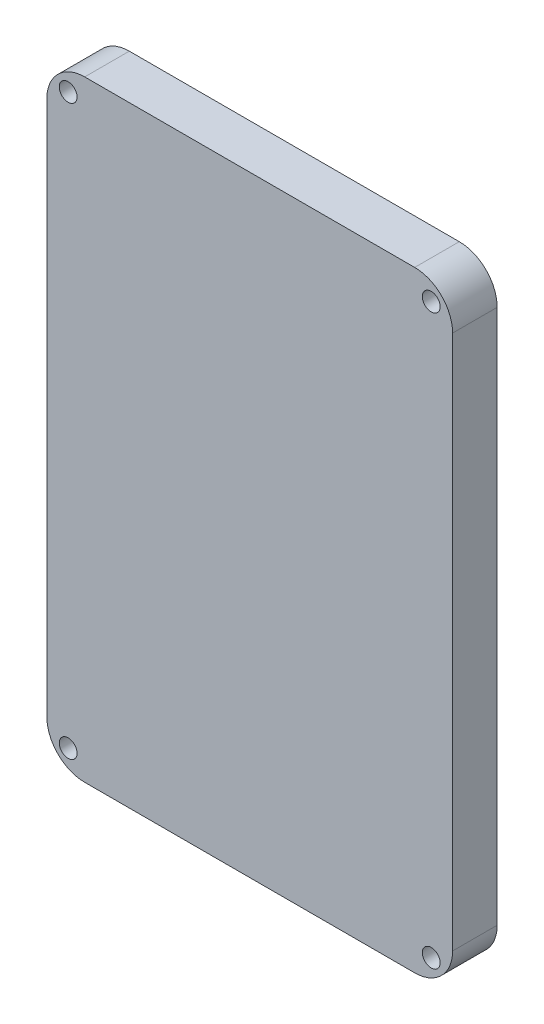
from build123d import *

# Parameters (mm, degrees)
CASE_2_DEPTH            = 10
INTERNAL_START          = -2
INTERNAL_SLOT_DEPTH     = 3
CUT_EXTRUDE1_DEPTH      = 83.840207629
CUT_EXTRUDE1_DEPTH_BACK = 83.840207629
SKETCH3_R               = 2


with BuildPart() as part:
    # Sketch1 → Case 2 (new body)
    with BuildSketch(Plane(origin=(0, 0, 0), x_dir=(0, 1, 0), z_dir=(0, 0, 1))):
        with BuildLine():
            Line((-60, -45.5), (60, -45.5))
            ThreePointArc((60, -45.5), (66.01040764, -43.01040764), (68.5, -37))
            Line((68.5, -37), (68.5, 37))
            ThreePointArc((68.5, 37), (66.01040764, 43.01040764), (60, 45.5))
            Line((60, 45.5), (-60, 45.5))
            ThreePointArc((-60, 45.5), (-66.01040764, 43.01040764), (-68.5, 37))
            Line((-68.5, 37), (-68.5, -37))
            ThreePointArc((-68.5, -37), (-66.01040764, -43.01040764), (-60, -45.5))
        make_face()
    extrude(amount=CASE_2_DEPTH)

    # Sketch2 → internal slot (cut)
    with BuildSketch(Plane.XY.offset(10).offset(INTERNAL_START)):
        with BuildLine():
            Line((-37, -62), (37, -62))
            ThreePointArc((37, -62), (38.414213562, -61.414213562), (39, -60))
            Line((39, -60), (39, 60))
            ThreePointArc((39, 60), (38.414213562, 61.414213562), (37, 62))
            Line((37, 62), (-37, 62))
            ThreePointArc((-37, 62), (-38.414213562, 61.414213562), (-39, 60))
            Line((-39, 60), (-39, -60))
            ThreePointArc((-39, -60), (-38.414213562, -61.414213562), (-37, -62))
        make_face()
    extrude(amount=-INTERNAL_SLOT_DEPTH, mode=Mode.SUBTRACT)

    # Sketch3 → Cut-Extrude1 (cut, two sides: drawn at the far end of the back side and taken through both)
    with BuildSketch(Plane.XY.offset(10).offset(-CUT_EXTRUDE1_DEPTH_BACK)):
        with Locations((-40.712310601, 63.712310601)):
            Circle(SKETCH3_R)
        with Locations(Location((-40.712310601, -63.712310601, 0), (0, 0, 180))):
            Circle(SKETCH3_R)
        with Locations(Location((40.712310601, 63.712310601, 0), (0, 0, 180))):
            Circle(SKETCH3_R)
        with Locations((40.712310601, -63.712310601)):
            Circle(SKETCH3_R)
    extrude(amount=CUT_EXTRUDE1_DEPTH + CUT_EXTRUDE1_DEPTH_BACK, mode=Mode.SUBTRACT)


solid = part.part
